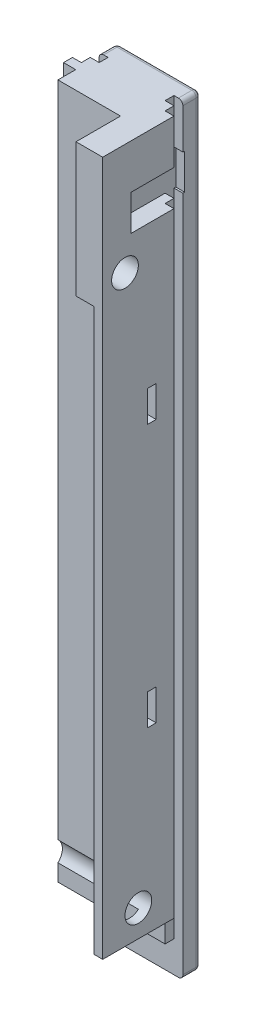
from build123d import *

# Parameters (mm, degrees)
SKETCH1_W           = 9.4
SKETCH1_H           = 2
BOSS_EXTRUDE1_DEPTH = 85.5
BOSS_EXTRUDE2_DEPTH = 81
FILLET1_R           = 0.5
BOSS_EXTRUDE3_DEPTH = 78
SKETCH2_R           = 1.5
CUT_EXTRUDE1_DEPTH  = 87.643786319
CUT_EXTRUDE2_REACH  = 88.644
SKETCH2_3_W         = 4.8
SKETCH2_3_H         = 4
SKETCH2_3_W_2       = 2.2
SKETCH3_W           = 2
SKETCH3_H           = 63
CUT_EXTRUDE3_DEPTH  = 5
SKETCH4_W           = 1
SKETCH4_H           = 3.5
CUT_EXTRUDE4_DEPTH  = 2


with BuildPart() as part:
    # Sketch1 → Boss-Extrude1 (new body)
    with BuildSketch(Plane(origin=(0, 0, 0), x_dir=(1, 0, 0), z_dir=(0, 1, 0))):
        with Locations((0.278560628, 2.818575451)):
            Rectangle(SKETCH1_W, SKETCH1_H)
    extrude(amount=-BOSS_EXTRUDE1_DEPTH)

    # Sketch1<3> → Boss-Extrude2 (add)
    with BuildSketch(Plane(origin=(0, 0, 0), x_dir=(1, 0, 0), z_dir=(0, 1, 0))):
        Polygon((3.978560628, 1.818575451), (-3.421439372, 1.818575451), (-3.421439372, 0.818575451), (-4.421439372, 0.818575451), (-4.421439372, -0.181424549), (4.978560628, -0.181424549), (4.978560628, 0.818575451), (3.978560628, 0.818575451), align=None)
    extrude(amount=-BOSS_EXTRUDE2_DEPTH)

    # Fillet1
    fillet1_edges = [part.edges().sort_by_distance(p)[0] for p in [
        (-4.421439372, -85.5, -2.818575451),
        (4.978560628, -85.5, -2.818575451),
        (-4.421439372, 0, -2.818575451),
        (0.278560628, 0, -3.818575451),
        (4.978560628, 0, -2.818575451),
        (-4.421439372, -42.75, -3.818575451),
        (4.978560628, -42.75, -3.818575451),
        (0.278560628, -85.5, -3.818575451),
    ]]
    fillet(fillet1_edges, radius=FILLET1_R)

    # Sketch1<4> → Boss-Extrude3 (add)
    with BuildSketch(Plane(origin=(0, 0, 0), x_dir=(1, 0, 0), z_dir=(0, 1, 0))):
        Polygon((-5.421439372, -0.181424549), (-4.421439372, -0.181424549), (4.978560628, -0.181424549), (5.978560628, -0.181424549), (5.978560628, -8.181424549), (2.978560628, -8.181424549), (2.978560628, -3.181424549), (-4.050977977, -3.181424549), (-4.050977977, -1.181424549), (-5.421439372, -1.181424549), align=None)
    extrude(amount=-BOSS_EXTRUDE3_DEPTH)

    # Sketch2 → Cut-Extrude1 (cut, through all)
    with BuildSketch(Plane(origin=(5.978560628, 0, 0), x_dir=(0, 0, -1), z_dir=(1, 0, 0))):
        with Locations((-5.681424549, -12.5)):
            Circle(SKETCH2_R)
        with Locations((-4.181424549, -75)):
            Circle(SKETCH2_R)
    extrude(amount=-CUT_EXTRUDE1_DEPTH, mode=Mode.SUBTRACT)

    # Cut-Extrude2: up to this face of the body (flat: up to its plane)
    cut_extrude2_end = Plane(part.part.faces().sort_by_distance((3.978560628, -40.5, -1.318575451))[0])
    # Sketch2<3> → Cut-Extrude2 (cut, up to the picked face)
    with BuildSketch(Plane(origin=(5.978560628, 0, 0), x_dir=(0, 0, -1), z_dir=(1, 0, 0)), mode=Mode.PRIVATE) as cut_extrude2_sk1:
        with Locations((-2.581424549, -7)):
            Rectangle(SKETCH2_3_W, SKETCH2_3_H)
    cut_extrude2_tool1 = split(extrude(cut_extrude2_sk1.sketch, amount=-CUT_EXTRUDE2_REACH, mode=Mode.PRIVATE), bisect_by=cut_extrude2_end, keep=Keep.BOTH, mode=Mode.PRIVATE)
    # Sketch2<3> → Cut-Extrude2 (cut, up to the picked face)
    with BuildSketch(Plane(origin=(5.978560628, 0, 0), x_dir=(0, 0, -1), z_dir=(1, 0, 0)), mode=Mode.PRIVATE) as cut_extrude2_sk2:
        with Locations((0.918575451, -7)):
            Rectangle(SKETCH2_3_W_2, SKETCH2_3_H)
    cut_extrude2_tool2 = split(extrude(cut_extrude2_sk2.sketch, amount=-CUT_EXTRUDE2_REACH, mode=Mode.PRIVATE), bisect_by=cut_extrude2_end, keep=Keep.BOTH, mode=Mode.PRIVATE)
    add(cut_extrude2_tool1.solids().sort_by(Axis((5.978561, -7, 2.581425), (-1, 0, 0)))[0], mode=Mode.SUBTRACT)
    add(cut_extrude2_tool2.solids().sort_by(Axis((5.978561, -7, -0.918575), (-1, 0, 0)))[0], mode=Mode.SUBTRACT)

    # Sketch3 → Cut-Extrude3 (cut)
    with BuildSketch(Plane.XY.offset(8.181424549)):
        with Locations((3.978560628, -46.5)):
            Rectangle(SKETCH3_W, SKETCH3_H)
    extrude(amount=-CUT_EXTRUDE3_DEPTH, mode=Mode.SUBTRACT)

    # Sketch4 → Cut-Extrude4 (cut)
    with BuildSketch(Plane(origin=(5.978560628, 0, 0), x_dir=(0, 0, -1), z_dir=(1, 0, 0))):
        with Locations((-2.681424549, -26.75)):
            Rectangle(SKETCH4_W, SKETCH4_H)
        with Locations((-2.681424549, -56.25)):
            Rectangle(SKETCH4_W, SKETCH4_H)
    extrude(amount=-CUT_EXTRUDE4_DEPTH, mode=Mode.SUBTRACT)


solid = part.part
